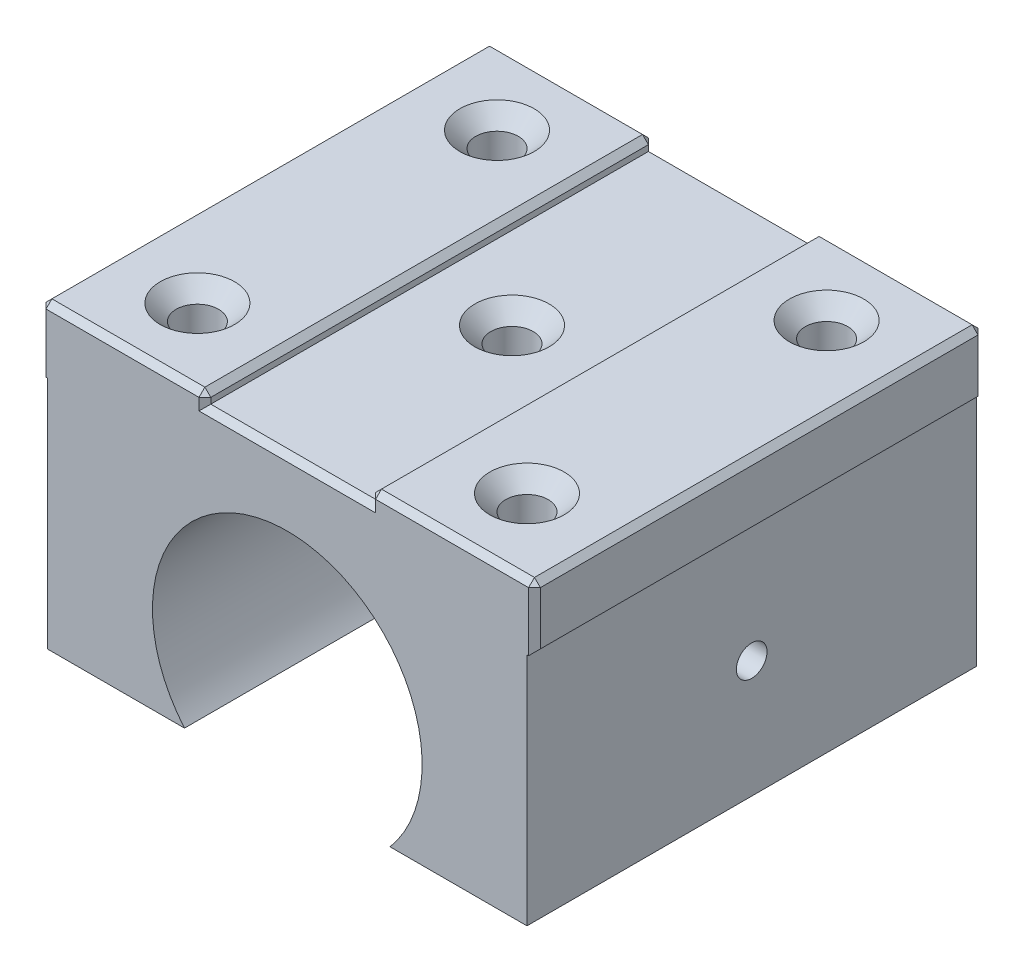
from build123d import *

# Parameters (mm, degrees)
BOSS_EXTRUDE1_DEPTH                                 = 38.1
CSK_FOR_M3_COUNTERSUNK_FLAT_HEAD_SCREW2_D           = 3.6
CSK_FOR_M3_COUNTERSUNK_FLAT_HEAD_SCREW2_DEPTH       = 10
CSK_FOR_M3_COUNTERSUNK_FLAT_HEAD_SCREW2_CSINK_D     = 6.3
CSK_FOR_M3_COUNTERSUNK_FLAT_HEAD_SCREW2_CSINK_ANGLE = 90
CSK_FOR_M3_COUNTERSUNK_FLAT_HEAD_SCREW2_TIP         = 1.081549114
CUT_EXTRUDE1_DEPTH                                  = 48.061034515
CUT_EXTRUDE1_DEPTH_BACK                             = 48.061034515
CSK_FOR_M3_COUNTERSUNK_FLAT_HEAD_SCREW3_D           = 3.6
CSK_FOR_M3_COUNTERSUNK_FLAT_HEAD_SCREW3_DEPTH       = 10
CSK_FOR_M3_COUNTERSUNK_FLAT_HEAD_SCREW3_CSINK_D     = 6.3
CSK_FOR_M3_COUNTERSUNK_FLAT_HEAD_SCREW3_CSINK_ANGLE = 90
CSK_FOR_M3_COUNTERSUNK_FLAT_HEAD_SCREW3_TIP         = 1.081549114
CHAMFER1_SIZE                                       = 0.5
CSK_FOR_M2_COUNTERSUNK_FLAT_HEAD_SCREW2_D           = 2.6
CSK_FOR_M2_COUNTERSUNK_FLAT_HEAD_SCREW2_CSINK_D     = 4.4
CSK_FOR_M2_COUNTERSUNK_FLAT_HEAD_SCREW2_CSINK_ANGLE = 90
LPATTERN1_COUNT                                     = 10
LPATTERN1_PITCH                                     = 3.122222222


with BuildPart() as part:
    # Sketch1 → Boss-Extrude1 (new body)
    with BuildSketch(Plane.XY):
        with BuildLine():
            Line((-20.32, 12.500526233), (-20.32, -7.399473767))
            Line((-20.32, -7.399473767), (-8.711640946, -7.399473767))
            ThreePointArc((-8.711640946, -7.399473767), (-10.373545324, 4.799422613), (0, 11.43))
            ThreePointArc((0, 11.43), (10.373545324, 4.799422613), (8.711640946, -7.399473767))
            Line((8.711640946, -7.399473767), (20.32, -7.399473767))
            Line((20.32, -7.399473767), (20.32, 12.500526233))
            Line((20.32, 12.500526233), (20.955, 12.500526233))
            Line((20.955, 12.500526233), (20.955, 18.000526233))
            Line((20.955, 18.000526233), (-20.955, 18.000526233))
            Line((-20.955, 18.000526233), (-20.955, 12.500526233))
            Line((-20.955, 12.500526233), (-20.32, 12.500526233))
        make_face()
    extrude(amount=BOSS_EXTRUDE1_DEPTH)

    # CSK for M3 Countersunk Flat Head Screw2
    with Locations(Plane(origin=(0, 18.000526233, 0), x_dir=(1, 0, 0), z_dir=(0, 1, 0))):
        with Locations((-13.97, -6.35), (-13.97, -31.75), (13.97, -31.75), (13.97, -6.35)):
            CounterSinkHole(CSK_FOR_M3_COUNTERSUNK_FLAT_HEAD_SCREW2_D / 2, CSK_FOR_M3_COUNTERSUNK_FLAT_HEAD_SCREW2_CSINK_D / 2, depth=CSK_FOR_M3_COUNTERSUNK_FLAT_HEAD_SCREW2_DEPTH, counter_sink_angle=CSK_FOR_M3_COUNTERSUNK_FLAT_HEAD_SCREW2_CSINK_ANGLE)
            with Locations((0, 0, -(CSK_FOR_M3_COUNTERSUNK_FLAT_HEAD_SCREW2_DEPTH + CSK_FOR_M3_COUNTERSUNK_FLAT_HEAD_SCREW2_TIP / 2))):  # 118° drill point
                Cone(0, CSK_FOR_M3_COUNTERSUNK_FLAT_HEAD_SCREW2_D / 2, CSK_FOR_M3_COUNTERSUNK_FLAT_HEAD_SCREW2_TIP, mode=Mode.SUBTRACT)

    # Sketch4 → Cut-Extrude1 (cut, two sides: drawn at the far end of the back side and taken through both)
    with BuildSketch(Plane.XY.offset(38.1).offset(-CUT_EXTRUDE1_DEPTH_BACK)):
        Polygon((-6.985, 103.520155469), (-6.985, 18.000526233), (-6.985, 17.000526233), (6.985, 17.000526233), (6.985, 18.000526233), (6.985, 103.520155469), (6.985, 274.559413942), (-6.985, 274.559413942), align=None)
    extrude(amount=CUT_EXTRUDE1_DEPTH + CUT_EXTRUDE1_DEPTH_BACK, mode=Mode.SUBTRACT)

    # CSK for M3 Countersunk Flat Head Screw3
    with Locations(Plane(origin=(0, 17.000526233, 0), x_dir=(1, 0, 0), z_dir=(0, 1, 0))):
        with Locations((0, -19.05)):
            CounterSinkHole(CSK_FOR_M3_COUNTERSUNK_FLAT_HEAD_SCREW3_D / 2, CSK_FOR_M3_COUNTERSUNK_FLAT_HEAD_SCREW3_CSINK_D / 2, depth=CSK_FOR_M3_COUNTERSUNK_FLAT_HEAD_SCREW3_DEPTH, counter_sink_angle=CSK_FOR_M3_COUNTERSUNK_FLAT_HEAD_SCREW3_CSINK_ANGLE)
            with Locations((0, 0, -(CSK_FOR_M3_COUNTERSUNK_FLAT_HEAD_SCREW3_DEPTH + CSK_FOR_M3_COUNTERSUNK_FLAT_HEAD_SCREW3_TIP / 2))):  # 118° drill point
                Cone(0, CSK_FOR_M3_COUNTERSUNK_FLAT_HEAD_SCREW3_D / 2, CSK_FOR_M3_COUNTERSUNK_FLAT_HEAD_SCREW3_TIP, mode=Mode.SUBTRACT)

    # Chamfer1
    chamfer1_edges = [part.edges().sort_by_distance(p)[0] for p in [
        (-20.955, 15.250526233, 0),
        (-13.97, 18.000526233, 0),
        (20.955, 15.250526233, 0),
        (-20.955, 12.500526233, 19.05),
        (-20.955, 18.000526233, 19.05),
        (20.955, 18.000526233, 19.05),
        (20.955, 12.500526233, 19.05),
        (20.955, 15.250526233, 38.1),
        (-13.97, 18.000526233, 38.1),
        (-20.955, 15.250526233, 38.1),
        (13.97, 18.000526233, 0),
        (6.985, 17.500526233, 0),
        (0, 17.000526233, 0),
        (-6.985, 17.500526233, 0),
        (13.97, 18.000526233, 38.1),
        (-6.985, 17.500526233, 38.1),
        (0, 17.000526233, 38.1),
        (6.985, 17.500526233, 38.1),
        (6.985, 18.000526233, 19.05),
        (-6.985, 18.000526233, 19.05),
    ]]
    chamfer(chamfer1_edges, length=CHAMFER1_SIZE)

    # CSK for M2 Countersunk Flat Head Screw2 (through all)
    with Locations(Plane.ZY.offset(20.32)):
        with Locations((19.05, 2.550526233)):
            CounterSinkHole(CSK_FOR_M2_COUNTERSUNK_FLAT_HEAD_SCREW2_D / 2, CSK_FOR_M2_COUNTERSUNK_FLAT_HEAD_SCREW2_CSINK_D / 2, counter_sink_angle=CSK_FOR_M2_COUNTERSUNK_FLAT_HEAD_SCREW2_CSINK_ANGLE)

    # Sketch16 → Revolve4 (revolve)
    with BuildSketch(Plane.XY.offset(33.1)):
        with BuildLine():
            Line((-7.375123728, 7.375123728), (-8.78933729, 8.78933729))
            ThreePointArc((-8.78933729, 8.78933729), (-7.375123728, 8.78933729), (-7.375123728, 7.375123728))
        make_face()
    revolve4 = revolve(axis=Axis((-8.082230509, 8.082230509, 33.1), (0.7071067811865464, -0.7071067811865488, 0)))

    # Mirror1: Revolve4 across plane
    add(revolve4.mirror(Plane(origin=(0, 0, 0), x_dir=(0, 0, 1), z_dir=(1, 0, 0))))

    # LPattern1: Revolve4 ×10
    with Locations(*[(0, 0, -i * LPATTERN1_PITCH) for i in range(1, LPATTERN1_COUNT)]):
        add(revolve4)

    # LPattern1 copy 1 sketch → LPattern1 copy 1 (revolve)
    with BuildSketch(Plane(origin=(0, 0, 29.977777778), x_dir=(-1, 0, 0), z_dir=(0, 0, 1))):
        with BuildLine():
            Line((-7.375123728, -7.375123728), (-8.78933729, -8.78933729))
            ThreePointArc((-8.78933729, -8.78933729), (-7.375123728, -8.78933729), (-7.375123728, -7.375123728))
        make_face()
    revolve(axis=Axis((8.082230509, 8.082230509, 29.977777778), (0.7071067811865464, 0.7071067811865488, 0)))

    # LPattern1 copy 2 sketch → LPattern1 copy 2 (revolve)
    with BuildSketch(Plane(origin=(0, 0, 26.855555556), x_dir=(-1, 0, 0), z_dir=(0, 0, 1))):
        with BuildLine():
            Line((-7.375123728, -7.375123728), (-8.78933729, -8.78933729))
            ThreePointArc((-8.78933729, -8.78933729), (-7.375123728, -8.78933729), (-7.375123728, -7.375123728))
        make_face()
    revolve(axis=Axis((8.082230509, 8.082230509, 26.855555556), (0.7071067811865464, 0.7071067811865488, 0)))

    # LPattern1 copy 3 sketch → LPattern1 copy 3 (revolve)
    with BuildSketch(Plane(origin=(0, 0, 23.733333333), x_dir=(-1, 0, 0), z_dir=(0, 0, 1))):
        with BuildLine():
            Line((-7.375123728, -7.375123728), (-8.78933729, -8.78933729))
            ThreePointArc((-8.78933729, -8.78933729), (-7.375123728, -8.78933729), (-7.375123728, -7.375123728))
        make_face()
    revolve(axis=Axis((8.082230509, 8.082230509, 23.733333333), (0.7071067811865464, 0.7071067811865488, 0)))

    # LPattern1 copy 4 sketch → LPattern1 copy 4 (revolve)
    with BuildSketch(Plane(origin=(0, 0, 20.611111111), x_dir=(-1, 0, 0), z_dir=(0, 0, 1))):
        with BuildLine():
            Line((-7.375123728, -7.375123728), (-8.78933729, -8.78933729))
            ThreePointArc((-8.78933729, -8.78933729), (-7.375123728, -8.78933729), (-7.375123728, -7.375123728))
        make_face()
    revolve(axis=Axis((8.082230509, 8.082230509, 20.611111111), (0.7071067811865464, 0.7071067811865488, 0)))

    # LPattern1 copy 5 sketch → LPattern1 copy 5 (revolve)
    with BuildSketch(Plane(origin=(0, 0, 17.488888889), x_dir=(-1, 0, 0), z_dir=(0, 0, 1))):
        with BuildLine():
            Line((-7.375123728, -7.375123728), (-8.78933729, -8.78933729))
            ThreePointArc((-8.78933729, -8.78933729), (-7.375123728, -8.78933729), (-7.375123728, -7.375123728))
        make_face()
    revolve(axis=Axis((8.082230509, 8.082230509, 17.488888889), (0.7071067811865464, 0.7071067811865488, 0)))

    # LPattern1 copy 6 sketch → LPattern1 copy 6 (revolve)
    with BuildSketch(Plane(origin=(0, 0, 14.366666667), x_dir=(-1, 0, 0), z_dir=(0, 0, 1))):
        with BuildLine():
            Line((-7.375123728, -7.375123728), (-8.78933729, -8.78933729))
            ThreePointArc((-8.78933729, -8.78933729), (-7.375123728, -8.78933729), (-7.375123728, -7.375123728))
        make_face()
    revolve(axis=Axis((8.082230509, 8.082230509, 14.366666667), (0.7071067811865464, 0.7071067811865488, 0)))

    # LPattern1 copy 7 sketch → LPattern1 copy 7 (revolve)
    with BuildSketch(Plane(origin=(0, 0, 11.244444444), x_dir=(-1, 0, 0), z_dir=(0, 0, 1))):
        with BuildLine():
            Line((-7.375123728, -7.375123728), (-8.78933729, -8.78933729))
            ThreePointArc((-8.78933729, -8.78933729), (-7.375123728, -8.78933729), (-7.375123728, -7.375123728))
        make_face()
    revolve(axis=Axis((8.082230509, 8.082230509, 11.244444444), (0.7071067811865464, 0.7071067811865488, 0)))

    # LPattern1 copy 8 sketch → LPattern1 copy 8 (revolve)
    with BuildSketch(Plane(origin=(0, 0, 8.122222222), x_dir=(-1, 0, 0), z_dir=(0, 0, 1))):
        with BuildLine():
            Line((-7.375123728, -7.375123728), (-8.78933729, -8.78933729))
            ThreePointArc((-8.78933729, -8.78933729), (-7.375123728, -8.78933729), (-7.375123728, -7.375123728))
        make_face()
    revolve(axis=Axis((8.082230509, 8.082230509, 8.122222222), (0.7071067811865464, 0.7071067811865488, 0)))

    # LPattern1 copy 9 sketch → LPattern1 copy 9 (revolve)
    with BuildSketch(Plane(origin=(0, 0, 5), x_dir=(-1, 0, 0), z_dir=(0, 0, 1))):
        with BuildLine():
            Line((-7.375123728, -7.375123728), (-8.78933729, -8.78933729))
            ThreePointArc((-8.78933729, -8.78933729), (-7.375123728, -8.78933729), (-7.375123728, -7.375123728))
        make_face()
    revolve(axis=Axis((8.082230509, 8.082230509, 5), (0.7071067811865464, 0.7071067811865488, 0)))


solid = part.part
